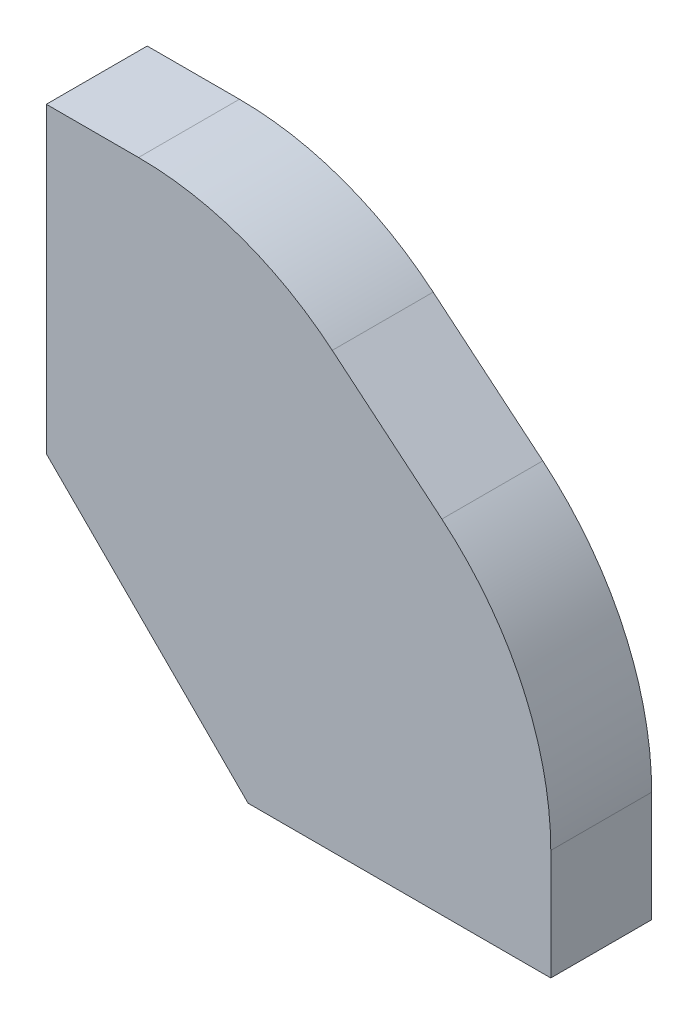
from build123d import *

# Parameters (mm, degrees)
BOSS_EXTRU_1_DEPTH = 10
CONG_2_R           = 30


with BuildPart() as part:
    # Esquisse1 → Boss.-Extru.1 (new body)
    with BuildSketch(Plane.XY):
        Polygon((-20, 20), (0, 0), (30, 0), (30, 25), (0, 50), (-20, 50), align=None)
    extrude(amount=BOSS_EXTRU_1_DEPTH)

    # Congé2
    cong_2_edges = [part.edges().sort_by_distance(p)[0] for p in [
        (0, 50, 5),
        (30, 25, 5),
    ]]
    fillet(cong_2_edges, radius=CONG_2_R)


solid = part.part
